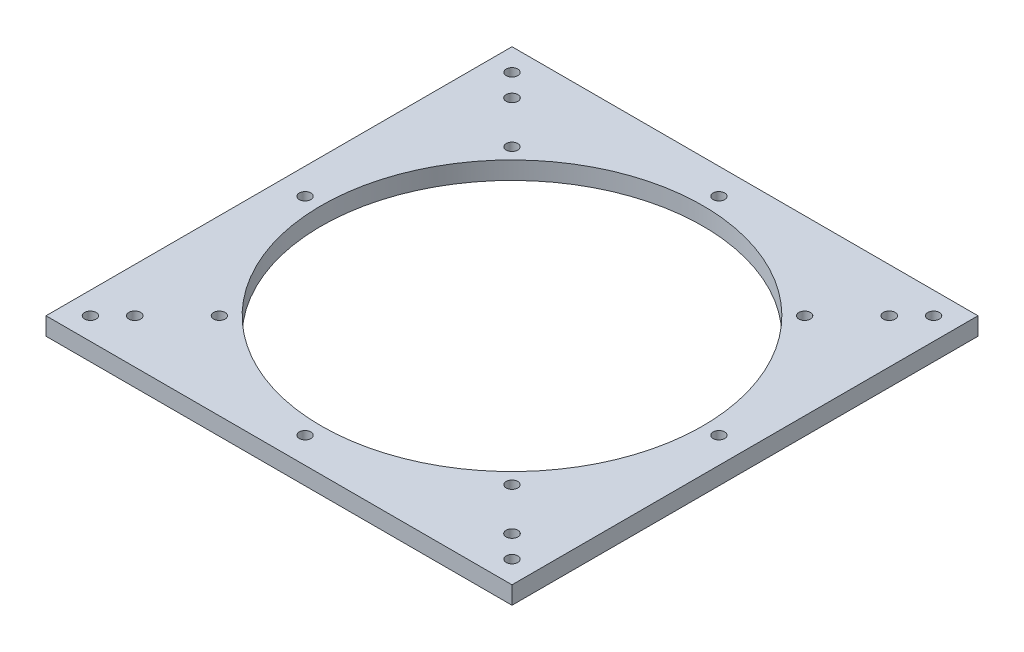
from build123d import *

# Parameters (mm, degrees)
SKETCH_1_W          = 210
SKETCH_1_H          = 210
SKETCH_1_R          = 85.5
SKETCH_1_R_2        = 2.6
EXTRUDE_1_DEPTH     = 8
SKETCH_2_R          = 2.6
CUT_EXTRUDE_1_DEPTH = 10
SKETCH_3_R          = 86
CUT_EXTRUDE_2_DEPTH = 10
SKETCH_4_R          = 2.65
CUT_EXTRUDE_3_DEPTH = 149.707767114


with BuildPart() as part:
    # 草图1 → 凸台-拉伸1 (new body)
    with BuildSketch(Plane(origin=(0, 0, 0), x_dir=(1, 0, 0), z_dir=(0, 1, 0))):
        Rectangle(SKETCH_1_W, SKETCH_1_H)
        with Locations(Location((0, 0, 0), (0, 0, 270))):
            Circle(SKETCH_1_R, mode=Mode.SUBTRACT)
        with Locations(Location((0, 93.25, 0), (0, 0, 270))):
            Circle(SKETCH_1_R_2, mode=Mode.SUBTRACT)
        with Locations(Location((93.25, 0, 0), (0, 0, 270))):
            Circle(SKETCH_1_R_2, mode=Mode.SUBTRACT)
        with Locations(Location((0, -93.25, 0), (0, 0, 270))):
            Circle(SKETCH_1_R_2, mode=Mode.SUBTRACT)
        with Locations(Location((-93.25, 0, 0), (0, 0, 270))):
            Circle(SKETCH_1_R_2, mode=Mode.SUBTRACT)
    extrude(amount=EXTRUDE_1_DEPTH)

    # 草图2 → 切除-拉伸1 (cut)
    with BuildSketch(Plane(origin=(0, 8, 0), x_dir=(1, 0, 0), z_dir=(0, 1, 0))):
        with Locations(Location((65.937707346, -65.937707346, 0), (0, 0, 270))):
            Circle(SKETCH_2_R)
        with Locations(Location((95, 95, 0), (0, 0, 270))):
            Circle(SKETCH_2_R)
        with Locations(Location((-65.937707346, 65.937707346, 0), (0, 0, 270))):
            Circle(SKETCH_2_R)
        with Locations(Location((65.937707346, 65.937707346, 0), (0, 0, 270))):
            Circle(SKETCH_2_R)
        with Locations(Location((-65.937707346, -65.937707346, 0), (0, 0, 270))):
            Circle(SKETCH_2_R)
        with Locations(Location((95, -95, 0), (0, 0, 270))):
            Circle(SKETCH_2_R)
        with Locations(Location((-95, -95, 0), (0, 0, 270))):
            Circle(SKETCH_2_R)
        with Locations(Location((-95, 95, 0), (0, 0, 270))):
            Circle(SKETCH_2_R)
    extrude(amount=-CUT_EXTRUDE_1_DEPTH, mode=Mode.SUBTRACT)

    # 草图3 → 切除-拉伸2 (cut)
    with BuildSketch(Plane(origin=(0, 8, 0), x_dir=(1, 0, 0), z_dir=(0, 1, 0))):
        with Locations(Location((0, 0, 0), (0, 0, 270))):
            Circle(SKETCH_3_R)
    extrude(amount=-CUT_EXTRUDE_2_DEPTH, mode=Mode.SUBTRACT)

    # 草图4 → 切除-拉伸3 (cut, through all)
    with BuildSketch(Plane(origin=(0, 8, 0), x_dir=(1, 0, 0), z_dir=(0, 1, 0))):
        with Locations(Location((85, 85, 0), (0, 0, 270))):
            Circle(SKETCH_4_R)
        with Locations(Location((-85, -85, 0), (0, 0, 270))):
            Circle(SKETCH_4_R)
        with Locations(Location((-85, 85, 0), (0, 0, 270))):
            Circle(SKETCH_4_R)
        with Locations(Location((85, -85, 0), (0, 0, 270))):
            Circle(SKETCH_4_R)
    extrude(amount=-CUT_EXTRUDE_3_DEPTH, mode=Mode.SUBTRACT)


solid = part.part
